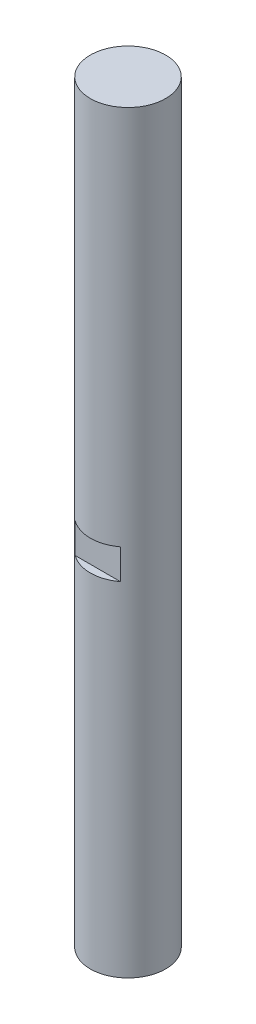
from build123d import *

# Parameters (mm, degrees)
SKETCH_1_R          = 5
EXTRUDE_1_DEPTH     = 100
CUT_EXTRUDE_START   = -45.5
CUT_EXTRUDE_1_DEPTH = 4


with BuildPart() as part:
    # Эскиз1 → Бобышка-Вытянуть1 (new body)
    with BuildSketch(Plane(origin=(0, 0, 0), x_dir=(1, 0, 0), z_dir=(0, 1, 0))):
        with Locations(Location((0, 0, 0), (0, 0, 270))):
            Circle(SKETCH_1_R)
    extrude(amount=EXTRUDE_1_DEPTH)

    # Эскиз2 → Вырез-Вытянуть1 (cut)
    with BuildSketch(Plane.XZ.offset(CUT_EXTRUDE_START)):
        with BuildLine():
            Line((-3, 4), (3, 4))
            ThreePointArc((3, 4), (0, 5), (-3, 4))
        make_face()
    extrude(amount=-CUT_EXTRUDE_1_DEPTH, mode=Mode.SUBTRACT)


solid = part.part
